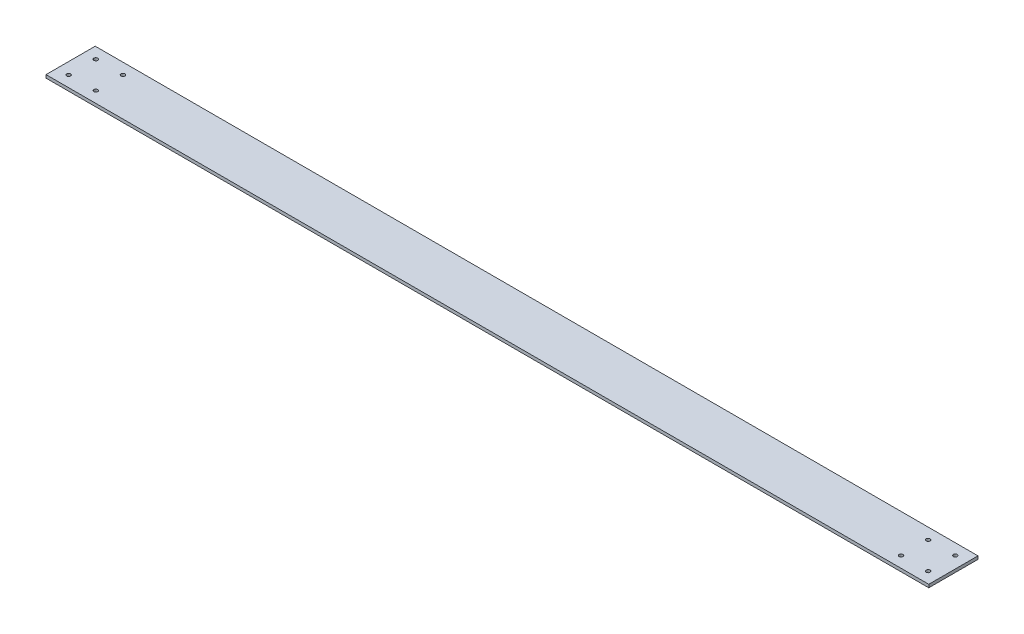
from build123d import *

# Parameters (mm, degrees)
SKETCH1_W           = 910.88
SKETCH1_H           = 50.8
SKETCH1_R           = 2
BOSS_EXTRUDE1_DEPTH = 3.175


with BuildPart() as part:
    # Sketch1 → Boss-Extrude1 (new body)
    with BuildSketch(Plane(origin=(0, 0, 0), x_dir=(1, 0, 0), z_dir=(0, 1, 0))):
        with Locations((455.44, 25.4)):
            Rectangle(SKETCH1_W, SKETCH1_H)
        with Locations(Location((12, 39.4, 0), (0, 0, 270))):
            Circle(SKETCH1_R, mode=Mode.SUBTRACT)
        with Locations(Location((12, 11.4, 0), (0, 0, 270))):
            Circle(SKETCH1_R, mode=Mode.SUBTRACT)
        with Locations(Location((898.88, 39.4, 0), (0, 0, 270))):
            Circle(SKETCH1_R, mode=Mode.SUBTRACT)
        with Locations(Location((898.88, 11.4, 0), (0, 0, 270))):
            Circle(SKETCH1_R, mode=Mode.SUBTRACT)
        with Locations(Location((40, 39.4, 0), (0, 0, 270))):
            Circle(SKETCH1_R, mode=Mode.SUBTRACT)
        with Locations(Location((40, 11.4, 0), (0, 0, 270))):
            Circle(SKETCH1_R, mode=Mode.SUBTRACT)
        with Locations(Location((870.88, 39.4, 0), (0, 0, 270))):
            Circle(SKETCH1_R, mode=Mode.SUBTRACT)
        with Locations(Location((870.88, 11.4, 0), (0, 0, 270))):
            Circle(SKETCH1_R, mode=Mode.SUBTRACT)
    extrude(amount=BOSS_EXTRUDE1_DEPTH)


solid = part.part
